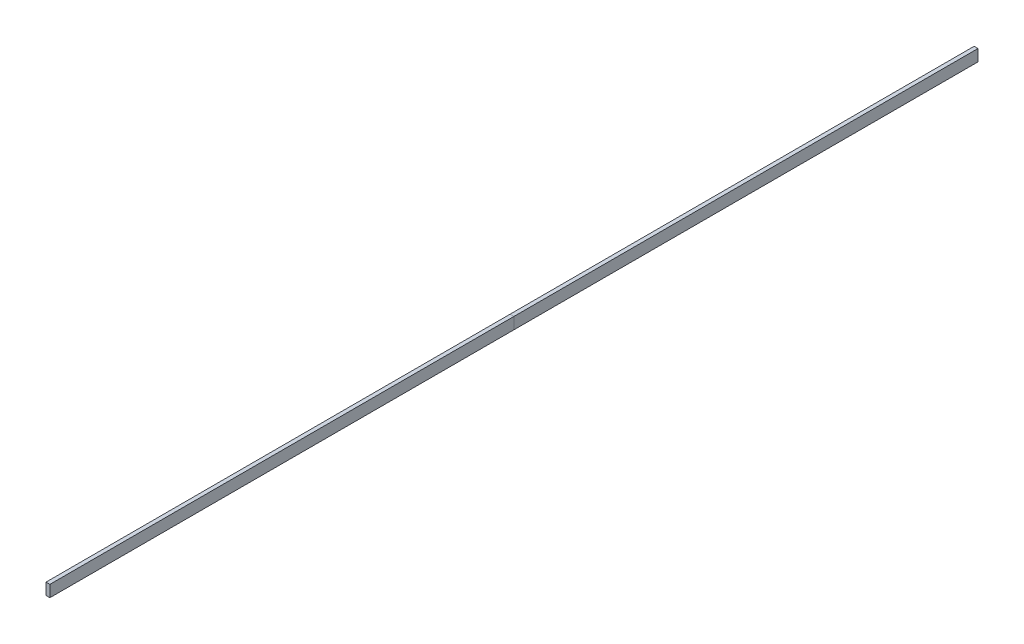
from build123d import *

# Parameters (mm, degrees)
SKETCH1_W      = 25.4
SKETCH1_H      = 76.2
EXTRUDE1_DEPTH = 3048
SKETCH2_W      = 25.4
SKETCH2_H      = 76.2
EXTRUDE2_DEPTH = 3048


with BuildPart() as part:
    # Sketch1 → Extrude1 (new body)
    with BuildSketch(Plane.XY):
        Rectangle(SKETCH1_W, SKETCH1_H)
    extrude(amount=EXTRUDE1_DEPTH)


with BuildPart() as body_2:
    # Sketch2 → Extrude2 (new body)
    with BuildSketch(Plane.XY.offset(3048)):
        Rectangle(SKETCH2_W, SKETCH2_H)
    extrude(amount=EXTRUDE2_DEPTH)


solid = Compound([part.part, body_2.part])
